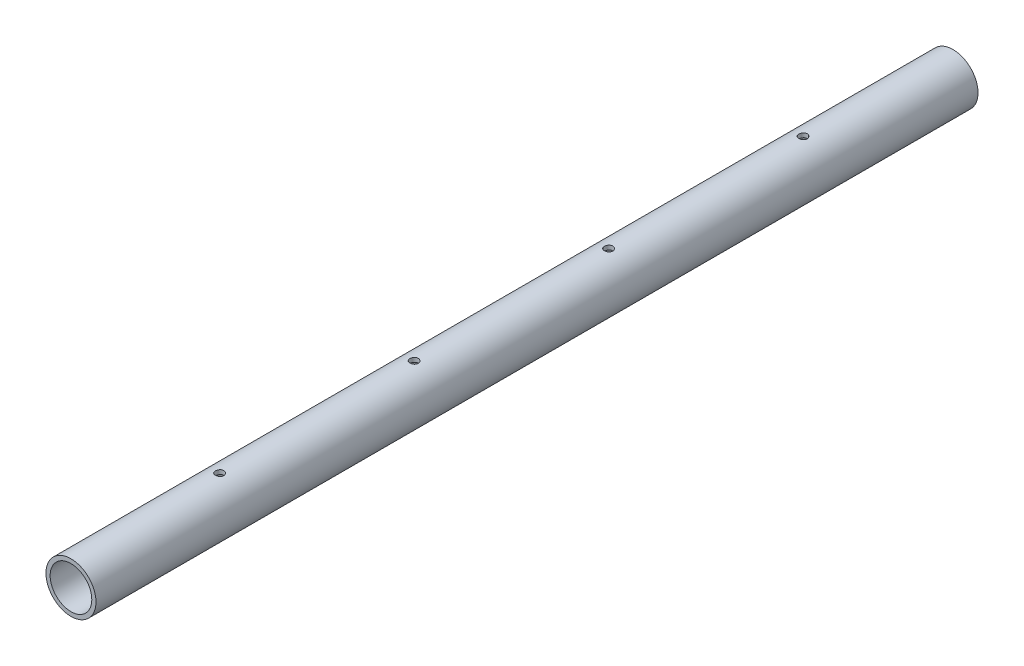
from build123d import *

# Parameters (mm, degrees)
ESQUISSE1_R                = 18
ESQUISSE1_R_2              = 15
EXTRU_MINCE1_DEPTH         = 635
ESQUISSE2_R                = 3
ENL_V_MAT_EXTRU_1_DEPTH    = 30
R_P_TITION_LIN_AIRE1_COUNT = 4
R_P_TITION_LIN_AIRE1_PITCH = 140


with BuildPart() as part:
    # Esquisse1 → Extru.-Mince1 (new body)
    with BuildSketch(Plane.XY):
        Circle(ESQUISSE1_R)
        Circle(ESQUISSE1_R_2, mode=Mode.SUBTRACT)
    extrude(amount=EXTRU_MINCE1_DEPTH)

    # Esquisse2 → Enlèv. mat.-Extru.1 (cut, symmetric)
    with BuildSketch(Plane(origin=(0, 0, 0), x_dir=(1, 0, 0), z_dir=(0, 1, 0))):
        with Locations((0, -108)):
            Circle(ESQUISSE2_R)
    enl_v_mat_extru_1 = extrude(amount=ENL_V_MAT_EXTRU_1_DEPTH, both=True, mode=Mode.SUBTRACT)

    # Répétition linéaire1: Enlèv. mat.-Extru.1 ×4
    with Locations(*[(0, 0, i * R_P_TITION_LIN_AIRE1_PITCH) for i in range(1, R_P_TITION_LIN_AIRE1_COUNT)]):
        add(enl_v_mat_extru_1, mode=Mode.SUBTRACT)


solid = part.part
